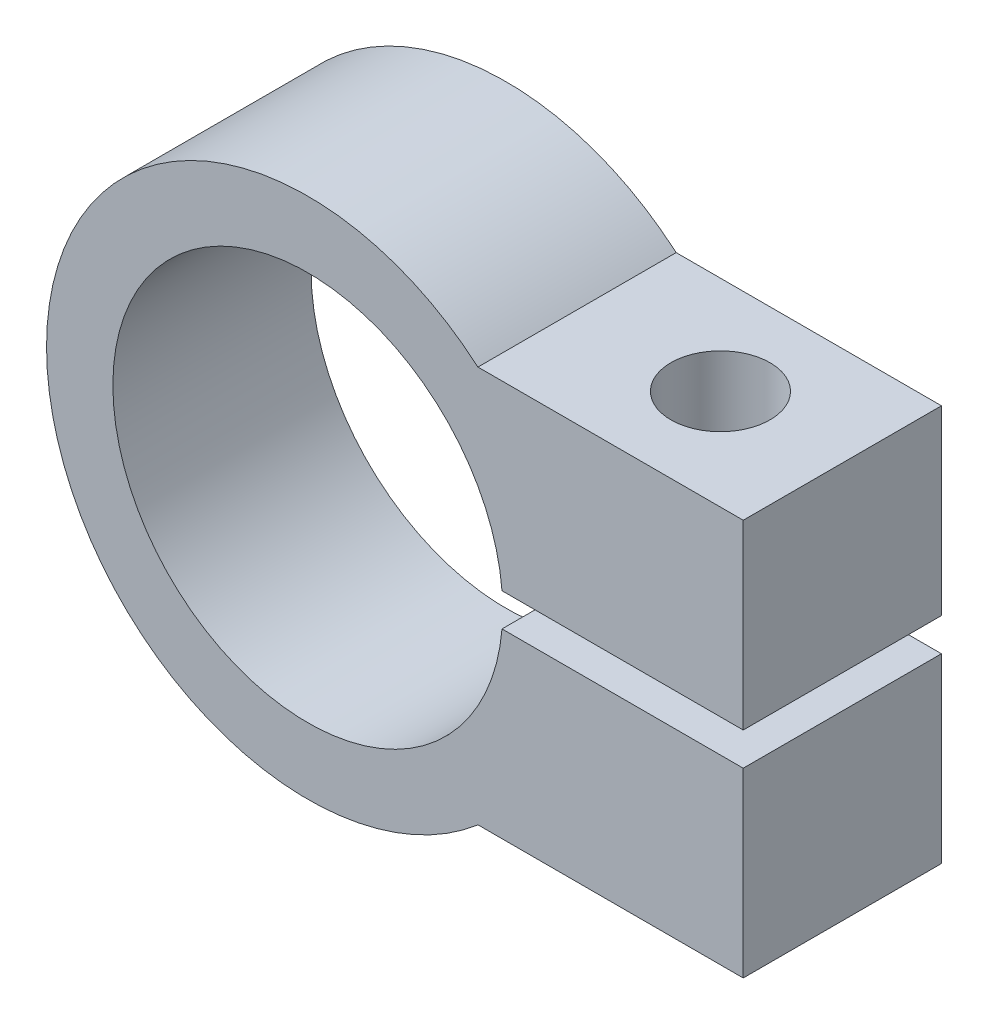
from build123d import *

# Parameters (mm, degrees)
BOSS_EXTRUDE1_DEPTH = 6
SKETCH2_R           = 1.5
CUT_EXTRUDE1_DEPTH  = 14


with BuildPart() as part:
    # Sketch1 → Boss-Extrude1 (new body)
    with BuildSketch(Plane.XY):
        with BuildLine():
            Line((-32.822846092, 55.253207469), (-40.85246604, 55.253207469))
            ThreePointArc((-40.85246604, 55.253207469), (-53.910402863, 49.253207469), (-40.85246604, 43.253207469))
            Line((-40.85246604, 43.253207469), (-32.822846092, 43.253207469))
            Line((-32.822846092, 43.253207469), (-32.822846092, 48.753207469))
            Line((-32.822846092, 48.753207469), (-38.111345814, 48.753207469))
            Line((-38.111345814, 48.753207469), (-40.124187091, 48.753207469))
            ThreePointArc((-40.124187091, 48.753207469), (-51.902962473, 49.253207469), (-40.124187091, 49.753207469))
            Line((-40.124187091, 49.753207469), (-38.111345814, 49.753207469))
            Line((-38.111345814, 49.753207469), (-32.822846092, 49.753207469))
            Line((-32.822846092, 49.753207469), (-32.822846092, 55.253207469))
        make_face()
    extrude(amount=BOSS_EXTRUDE1_DEPTH)

    # Sketch2 → Cut-Extrude1 (cut)
    with BuildSketch(Plane(origin=(0, 55.253207469, 0), x_dir=(1, 0, 0), z_dir=(0, 1, 0))):
        with Locations(Location((-36.547451728, -2.96481335, 0), (0, 0, 180))):
            Circle(SKETCH2_R)
    extrude(amount=-CUT_EXTRUDE1_DEPTH, mode=Mode.SUBTRACT)


solid = part.part
